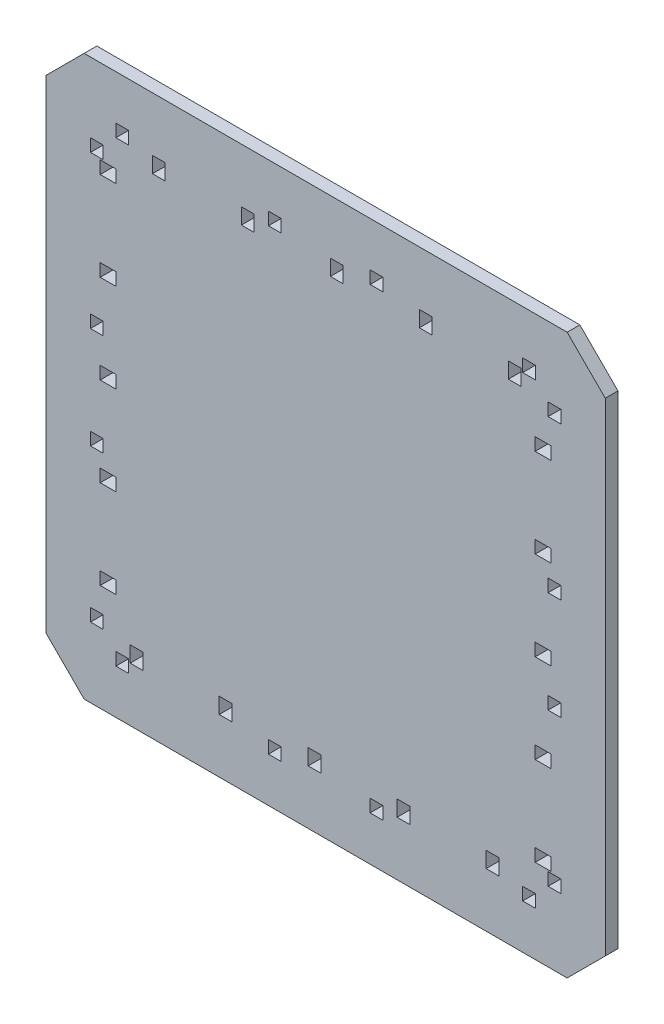
from build123d import *

# Parameters (mm, degrees)
SKETCH1_W           = 3
SKETCH1_H           = 3
SKETCH1_W_2         = 3.744317383
SKETCH1_H_2         = 3.744317383
BOSS_EXTRUDE1_DEPTH = 3


with BuildPart() as part:
    # Sketch1 → Boss-Extrude1 (new body)
    with BuildSketch(Plane.XY):
        Polygon((12, 297), (3, 288), (3, 174), (12, 165), (126, 165), (135, 174), (135, 288), (126, 297), align=None)
        with Locations((57, 285)):
            Rectangle(SKETCH1_W, SKETCH1_H, mode=Mode.SUBTRACT)
        with Locations((81, 285)):
            Rectangle(SKETCH1_W, SKETCH1_H, mode=Mode.SUBTRACT)
        with Locations((21, 285)):
            Rectangle(SKETCH1_W, SKETCH1_H, mode=Mode.SUBTRACT)
        with Locations((117, 285)):
            Rectangle(SKETCH1_W, SKETCH1_H, mode=Mode.SUBTRACT)
        with Locations((81, 177)):
            Rectangle(SKETCH1_W, SKETCH1_H, mode=Mode.SUBTRACT)
        with Locations((57, 177)):
            Rectangle(SKETCH1_W, SKETCH1_H, mode=Mode.SUBTRACT)
        with Locations((117, 177)):
            Rectangle(SKETCH1_W, SKETCH1_H, mode=Mode.SUBTRACT)
        with Locations((21, 177)):
            Rectangle(SKETCH1_W, SKETCH1_H, mode=Mode.SUBTRACT)
        with Locations((15, 279)):
            Rectangle(SKETCH1_W, SKETCH1_H, mode=Mode.SUBTRACT)
        with Locations((15, 183)):
            Rectangle(SKETCH1_W, SKETCH1_H, mode=Mode.SUBTRACT)
        with Locations((15, 243)):
            Rectangle(SKETCH1_W, SKETCH1_H, mode=Mode.SUBTRACT)
        with Locations((15, 219)):
            Rectangle(SKETCH1_W, SKETCH1_H, mode=Mode.SUBTRACT)
        with Locations((123, 183)):
            Rectangle(SKETCH1_W, SKETCH1_H, mode=Mode.SUBTRACT)
        with Locations((123, 279)):
            Rectangle(SKETCH1_W, SKETCH1_H, mode=Mode.SUBTRACT)
        with Locations((123, 219)):
            Rectangle(SKETCH1_W, SKETCH1_H, mode=Mode.SUBTRACT)
        with Locations((123, 243)):
            Rectangle(SKETCH1_W, SKETCH1_H, mode=Mode.SUBTRACT)
        with Locations((17.66659907, 212.625)):
            Rectangle(SKETCH1_W_2, SKETCH1_H, mode=Mode.SUBTRACT)
        with Locations((17.66659907, 254.625)):
            Rectangle(SKETCH1_W_2, SKETCH1_H, mode=Mode.SUBTRACT)
        with Locations((17.66659907, 233.625)):
            Rectangle(SKETCH1_W_2, SKETCH1_H, mode=Mode.SUBTRACT)
        with Locations((17.66659907, 275.625)):
            Rectangle(SKETCH1_W_2, SKETCH1_H, mode=Mode.SUBTRACT)
        with Locations((17.66659907, 191.625)):
            Rectangle(SKETCH1_W_2, SKETCH1_H, mode=Mode.SUBTRACT)
        with Locations((87.375, 179.666599071)):
            Rectangle(SKETCH1_W, SKETCH1_H_2, mode=Mode.SUBTRACT)
        with Locations((45.375, 179.666599071)):
            Rectangle(SKETCH1_W, SKETCH1_H_2, mode=Mode.SUBTRACT)
        with Locations((66.375, 179.666599071)):
            Rectangle(SKETCH1_W, SKETCH1_H_2, mode=Mode.SUBTRACT)
        with Locations((24.375, 179.666599071)):
            Rectangle(SKETCH1_W, SKETCH1_H_2, mode=Mode.SUBTRACT)
        with Locations((108.375, 179.666599071)):
            Rectangle(SKETCH1_W, SKETCH1_H_2, mode=Mode.SUBTRACT)
        with Locations((120.33340093, 249.375)):
            Rectangle(SKETCH1_W_2, SKETCH1_H, mode=Mode.SUBTRACT)
        with Locations((120.33340093, 207.375)):
            Rectangle(SKETCH1_W_2, SKETCH1_H, mode=Mode.SUBTRACT)
        with Locations((120.33340093, 228.375)):
            Rectangle(SKETCH1_W_2, SKETCH1_H, mode=Mode.SUBTRACT)
        with Locations((120.33340093, 186.375)):
            Rectangle(SKETCH1_W_2, SKETCH1_H, mode=Mode.SUBTRACT)
        with Locations((120.33340093, 270.375)):
            Rectangle(SKETCH1_W_2, SKETCH1_H, mode=Mode.SUBTRACT)
        with Locations((50.625, 282.33340093)):
            Rectangle(SKETCH1_W, SKETCH1_H_2, mode=Mode.SUBTRACT)
        with Locations((92.625, 282.33340093)):
            Rectangle(SKETCH1_W, SKETCH1_H_2, mode=Mode.SUBTRACT)
        with Locations((71.625, 282.33340093)):
            Rectangle(SKETCH1_W, SKETCH1_H_2, mode=Mode.SUBTRACT)
        with Locations((113.625, 282.33340093)):
            Rectangle(SKETCH1_W, SKETCH1_H_2, mode=Mode.SUBTRACT)
        with Locations((29.625, 282.33340093)):
            Rectangle(SKETCH1_W, SKETCH1_H_2, mode=Mode.SUBTRACT)
    extrude(amount=BOSS_EXTRUDE1_DEPTH)


solid = part.part
